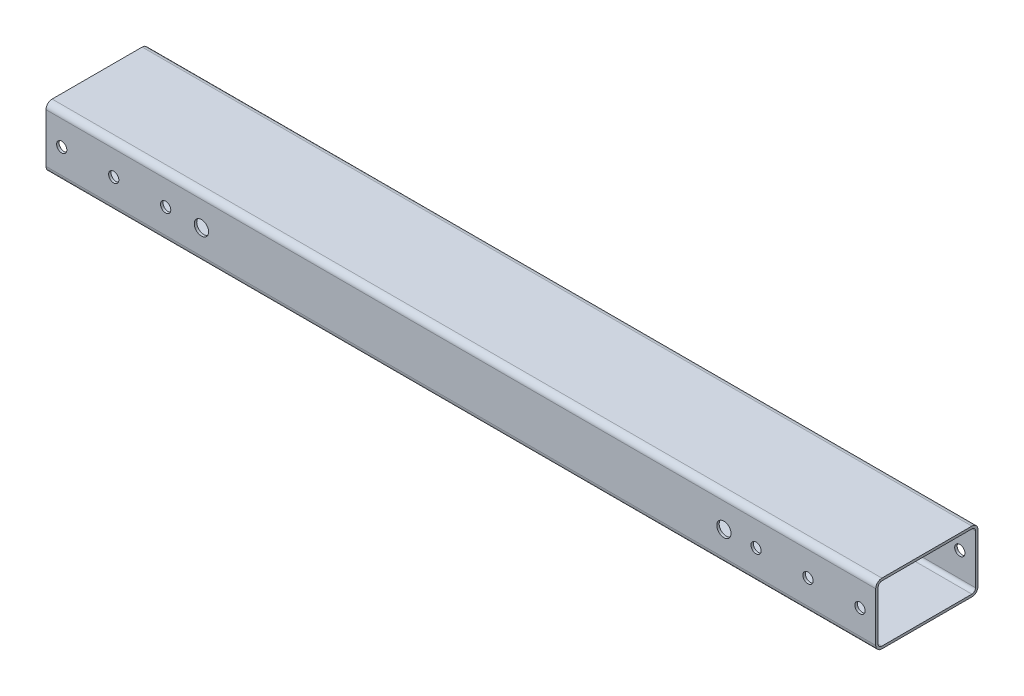
from build123d import *

# Parameters (mm, degrees)
TUBO_RETANGULAR_50_X_30_X_2_6_1_DEPTH = 405.6
ESBO_O2_R                             = 2.5
CORTE_EXTRUS_O1_DEPTH                 = 409.945424232
ESBO_O3_R                             = 3.5
CORTE_EXTRUS_O2_DEPTH                 = 409.945424232


with BuildPart() as part:
    # Sketch1 → Tubo retangular 50 X 30 X 2.6(1) (new body)
    with BuildSketch(Plane.YZ):
        with BuildLine():
            Line((-12, -25), (12, -25))
            ThreePointArc((12, -25), (14.121320344, -24.121320344), (15, -22))
            Line((15, -22), (15, 22))
            ThreePointArc((15, 22), (14.121320344, 24.121320344), (12, 25))
            Line((12, 25), (-12, 25))
            ThreePointArc((-12, 25), (-14.121320344, 24.121320344), (-15, 22))
            Line((-15, 22), (-15, -22))
            ThreePointArc((-15, -22), (-14.121320344, -24.121320344), (-12, -25))
        make_face()
        with BuildLine():
            Line((-12, -23.8), (12, -23.8))
            ThreePointArc((12, -23.8), (13.272792206, -23.272792206), (13.8, -22))
            Line((13.8, -22), (13.8, 22))
            ThreePointArc((13.8, 22), (13.272792206, 23.272792206), (12, 23.8))
            Line((12, 23.8), (-12, 23.8))
            ThreePointArc((-12, 23.8), (-13.272792206, 23.272792206), (-13.8, 22))
            Line((-13.8, 22), (-13.8, -22))
            ThreePointArc((-13.8, -22), (-13.272792206, -23.272792206), (-12, -23.8))
        make_face(mode=Mode.SUBTRACT)
    extrude(amount=TUBO_RETANGULAR_50_X_30_X_2_6_1_DEPTH)

    # Esboço2 → Corte-extrusão1 (cut, through all)
    with BuildSketch(Plane(origin=(0, 0, -25), x_dir=(-1, 0, 0), z_dir=(0, 0, -1))):
        with Locations((-58.5, 0)):
            Circle(ESBO_O2_R)
        with Locations((-33.1, 0)):
            Circle(ESBO_O2_R)
        with Locations((-7.7, 0)):
            Circle(ESBO_O2_R)
        with Locations(Location((-397.9, 0, 0), (0, 0, 180))):
            Circle(ESBO_O2_R)
        with Locations(Location((-372.5, 0, 0), (0, 0, 180))):
            Circle(ESBO_O2_R)
        with Locations(Location((-347.1, 0, 0), (0, 0, 180))):
            Circle(ESBO_O2_R)
    extrude(amount=-CORTE_EXTRUS_O1_DEPTH, mode=Mode.SUBTRACT)

    # Esboço3 → Corte-extrusão2 (cut, through all)
    with BuildSketch(Plane.XY.offset(25)):
        with Locations((75.984705047, 0)):
            Circle(ESBO_O3_R)
        with Locations((331.384705047, 0)):
            Circle(ESBO_O3_R)
    extrude(amount=-CORTE_EXTRUS_O2_DEPTH, mode=Mode.SUBTRACT)


solid = part.part
